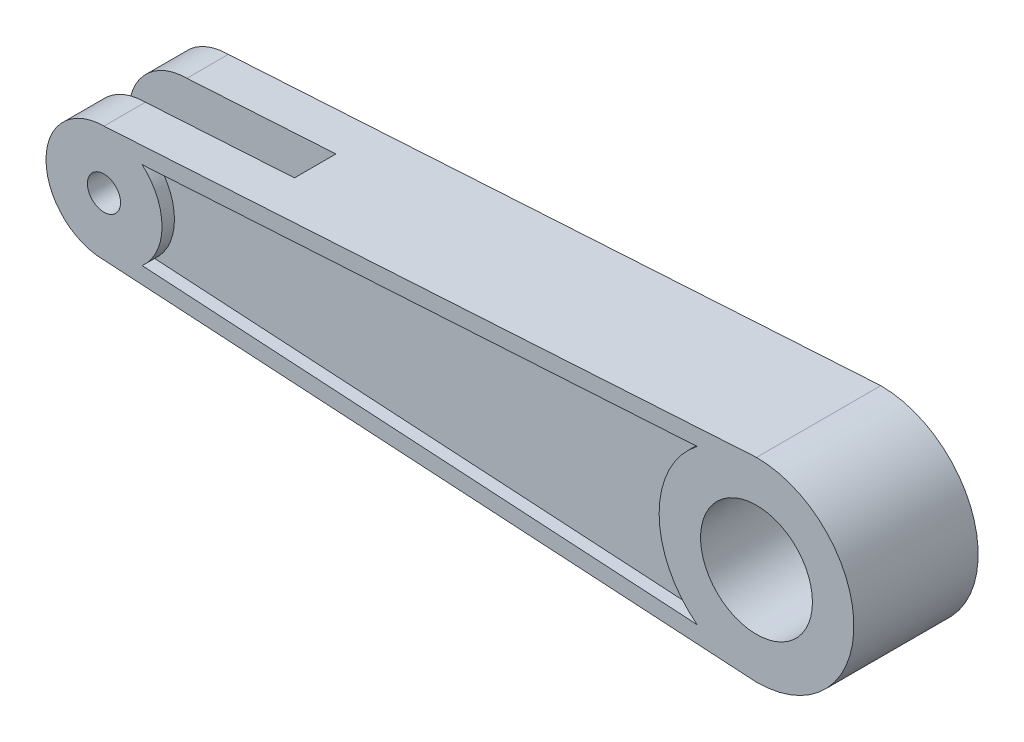
from build123d import *
from build123d.topology import SkipClean

# Parameters (mm, degrees)
BOSS_EXTRUDE1_DEPTH     = 30
CUT_EXTRUDE1_DEPTH      = 5
CUT_EXTRUDE1_DEPTH_BACK = 5
SKETCH2_R               = 4
CUT_EXTRUDE2_START      = -3
CUT_EXTRUDE2_DEPTH      = 3


with BuildPart() as part:
    # Sketch1 → Boss-Extrude1 (new body)
    with BuildSketch(Plane(origin=(0, 0, 0), x_dir=(-1, 0, 0), z_dir=(0, 0, 1))):
        with BuildLine():
            Line((0, 0), (10, 0))
            ThreePointArc((10, 0), (23.5, 13.5), (37, 0))
            Line((37, 0), (153.995672066, 0))
            Line((153.995672066, 0), (176.985, 0))
            ThreePointArc((176.985, 0), (180.985, 4), (184.985, 0))
            Line((184.985, 0), (194.985, 0))
            ThreePointArc((194.985, 0), (190.884494937, 9.899494937), (180.985, 14))
            Line((180.985, 14), (23.5, 23.5))
            ThreePointArc((23.5, 23.5), (6.882990642, 16.617009358), (0, 0))
        make_face()
    boss_extrude1 = extrude(amount=BOSS_EXTRUDE1_DEPTH)

    # Mirror1: Boss-Extrude1 across Top Plane
    with SkipClean():  # the faces are left unmerged after this step: merging them gives an invalid solid
        add(boss_extrude1.mirror(Plane(origin=(0, 0, 0), x_dir=(1, 0, 0), z_dir=(0, 1, 0))))

    # Sketch2 → Cut-Extrude1 (cut, two sides: drawn at the far end of the back side and taken through both)
    with SkipClean():  # the faces are left unmerged after this step: merging them gives an invalid solid
        with BuildSketch(Plane.XY.offset(15).offset(-CUT_EXTRUDE1_DEPTH_BACK)):
            with BuildLine():
                Line((-145.016260464, 16.169749662), (-180.985, 14))
                ThreePointArc((-180.985, 14), (-194.985, 0), (-180.985, -14))
                Line((-180.985, -14), (-145.016260464, -16.169749662))
                Line((-145.016260464, -16.169749662), (-145.016260464, 16.169749662))
            make_face()
            with Locations(Location((-180.985, 0, 0), (0, 0, 180))):
                Circle(SKETCH2_R, mode=Mode.SUBTRACT)
        extrude(amount=CUT_EXTRUDE1_DEPTH + CUT_EXTRUDE1_DEPTH_BACK, mode=Mode.SUBTRACT)

    # Sketch3 → Cut-Extrude2 (cut)
    with SkipClean():  # the faces are left unmerged after this step: merging them gives an invalid solid
        with BuildSketch(Plane.XY.offset(30).offset(CUT_EXTRUDE2_START)):
            with BuildLine():
                Line((-171.779614491, 10.548027191), (-37.825745268, 18.628553956))
                ThreePointArc((-37.825745268, 18.628553956), (-47, 0), (-37.825745268, -18.628553956))
                Line((-37.825745268, -18.628553956), (-171.779614491, -10.548027191))
                ThreePointArc((-171.779614491, -10.548027191), (-166.985, 0), (-171.779614491, 10.548027191))
            make_face()
        cut_extrude2 = extrude(amount=CUT_EXTRUDE2_DEPTH, mode=Mode.SUBTRACT)

    # Mirror2: Cut-Extrude2 across plane
    with SkipClean():  # the faces are left unmerged after this step: merging them gives an invalid solid
        add(cut_extrude2.mirror(Plane.XY.offset(15)), mode=Mode.SUBTRACT)


solid = part.part
